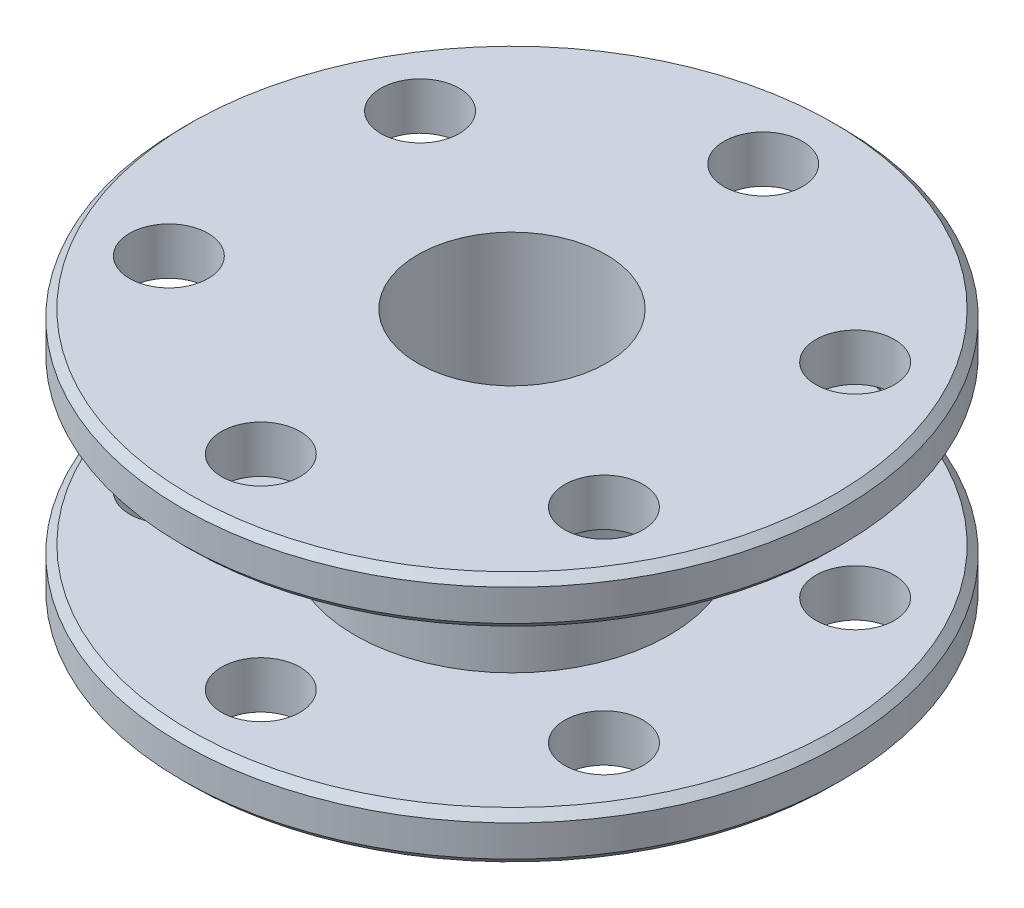
from build123d import *

# Parameters (mm, degrees)
SKETCH1_R           = 21
SKETCH1_R_2         = 6
SKETCH1_R_3         = 2.5
BOSS_EXTRUDE1_DEPTH = 16
SKETCH2_W           = 11.872629954
SKETCH2_H           = 10
CHAMFER2_SIZE       = 0.5


with BuildPart() as part:
    # Sketch1 → Boss-Extrude1 (new body)
    with BuildSketch(Plane(origin=(0, 0, 0), x_dir=(1, 0, 0), z_dir=(0, 1, 0))):
        with Locations(Location((0, 0, 0), (0, 0, 270))):
            Circle(SKETCH1_R)
        with Locations(Location((0, 0, 0), (0, 0, 270))):
            Circle(SKETCH1_R_2, mode=Mode.SUBTRACT)
        with Locations(Location((0, 16, 0), (0, 0, 270))):
            Circle(SKETCH1_R_3, mode=Mode.SUBTRACT)
        with Locations(Location((13.856406461, 8, 0), (0, 0, 270))):
            Circle(SKETCH1_R_3, mode=Mode.SUBTRACT)
        with Locations(Location((13.856406461, -8, 0), (0, 0, 270))):
            Circle(SKETCH1_R_3, mode=Mode.SUBTRACT)
        with Locations(Location((0, -16, 0), (0, 0, 270))):
            Circle(SKETCH1_R_3, mode=Mode.SUBTRACT)
        with Locations(Location((-13.856406461, -8, 0), (0, 0, 270))):
            Circle(SKETCH1_R_3, mode=Mode.SUBTRACT)
        with Locations(Location((-13.856406461, 8, 0), (0, 0, 270))):
            Circle(SKETCH1_R_3, mode=Mode.SUBTRACT)
    extrude(amount=BOSS_EXTRUDE1_DEPTH)

    # Sketch2 → Cut-Revolve1 (revolve, cut)
    with BuildSketch(Plane(origin=(0, 0, 0), x_dir=(0, 0, -1), z_dir=(1, 0, 0))):
        with Locations((15.936314977, 8)):
            Rectangle(SKETCH2_W, SKETCH2_H)
    revolve(axis=Axis((0, 0, 0), (0, 1, 0)), mode=Mode.SUBTRACT)

    # Chamfer2
    chamfer2_edges = [part.edges().sort_by_distance(p)[0] for p in [
        (0, 0, -21),
        (0, 3, -21),
        (0, 13, -21),
        (0, 16, -21),
    ]]
    chamfer(chamfer2_edges, length=CHAMFER2_SIZE)


solid = part.part
